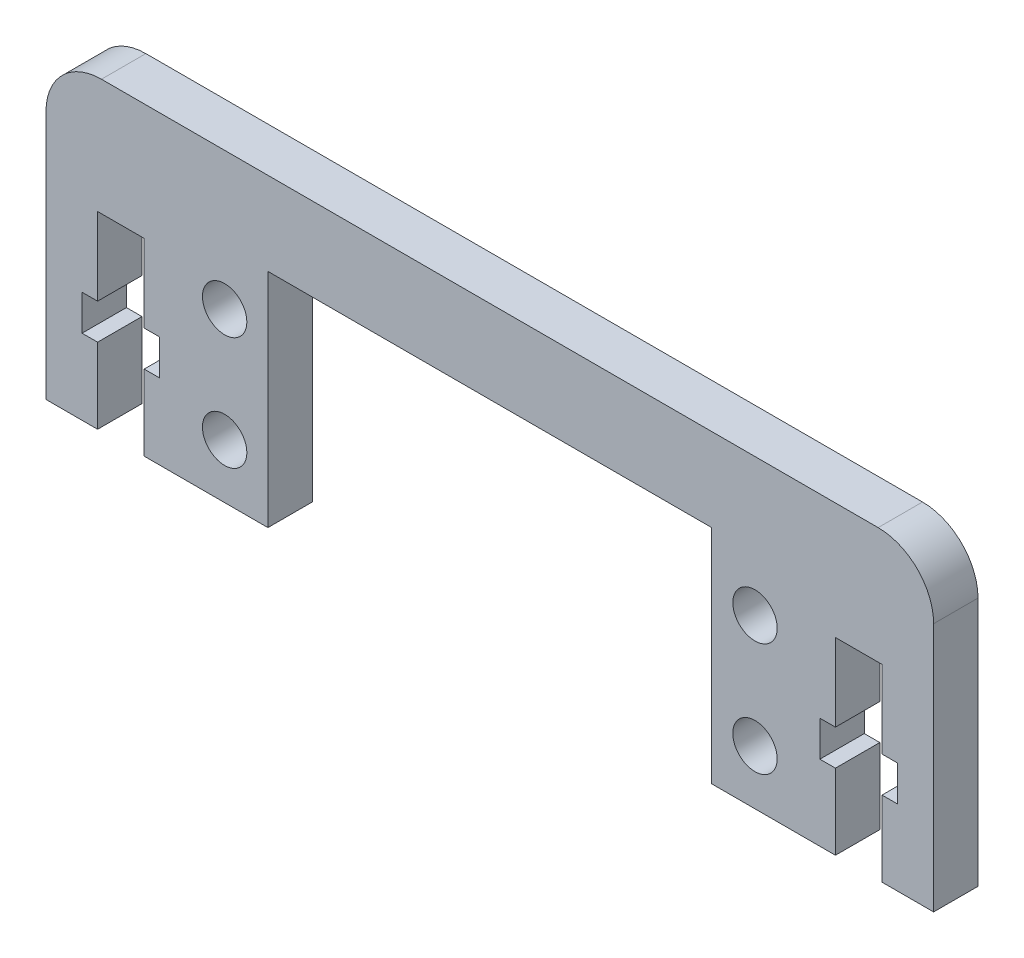
from build123d import *

# Parameters (mm, degrees)
ESQUISSE1_W             = 80
ESQUISSE1_H             = 27.5
BOSS_EXTRU_1_DEPTH      = 4
ESQUISSE2_R             = 2
ESQUISSE2_W             = 40
ESQUISSE2_H             = 20
ENL_V_MAT_EXTRU_1_DEPTH = 43.486027115
ENL_V_MAT_EXTRU_2_DEPTH = 43.486027115
CONG_1_R                = 5


with BuildPart() as part:
    # Esquisse1 → Boss.-Extru.1 (new body)
    with BuildSketch(Plane.XY):
        Rectangle(ESQUISSE1_W, ESQUISSE1_H)
    extrude(amount=BOSS_EXTRU_1_DEPTH)

    # Esquisse2 → Enlèv. mat.-Extru.1 (cut, through all)
    with BuildSketch(Plane(origin=(0, 0, 0), x_dir=(-1, 0, 0), z_dir=(0, 0, -1))):
        with Locations((-23.9, 1.35)):
            Circle(ESQUISSE2_R)
        with Locations(Location((-23.9, -8.85, 0), (0, 0, 180))):
            Circle(ESQUISSE2_R)
        with Locations((23.9, -8.85)):
            Circle(ESQUISSE2_R)
        with Locations(Location((23.9, 1.35, 0), (0, 0, 180))):
            Circle(ESQUISSE2_R)
        with Locations((0, -3.75)):
            Rectangle(ESQUISSE2_W, ESQUISSE2_H)
    extrude(amount=-ENL_V_MAT_EXTRU_1_DEPTH, mode=Mode.SUBTRACT)

    # Esquisse3 → Enlèv. mat.-Extru.2 (cut, through all)
    with BuildSketch(Plane(origin=(0, 0, 0), x_dir=(-1, 0, 0), z_dir=(0, 0, -1))):
        Polygon((31.15, -13.75), (35.35, -13.75), (35.35, -6.95), (36.75, -6.95), (36.75, -3.75), (35.35, -3.75), (35.35, 3.25), (31.15, 3.25), (31.15, -3.75), (29.75, -3.75), (29.75, -6.95), (31.15, -6.95), align=None)
        Polygon((-31.15, -13.75), (-31.15, -6.95), (-29.75, -6.95), (-29.75, -3.75), (-31.15, -3.75), (-31.15, 3.25), (-35.35, 3.25), (-35.35, -3.75), (-36.75, -3.75), (-36.75, -6.95), (-35.35, -6.95), (-35.35, -13.75), align=None)
    extrude(amount=-ENL_V_MAT_EXTRU_2_DEPTH, mode=Mode.SUBTRACT)

    # Congé1
    cong_1_edges = [part.edges().sort_by_distance(p)[0] for p in [
        (-40, 13.75, 2),
        (40, 13.75, 2),
    ]]
    fillet(cong_1_edges, radius=CONG_1_R)


solid = part.part
